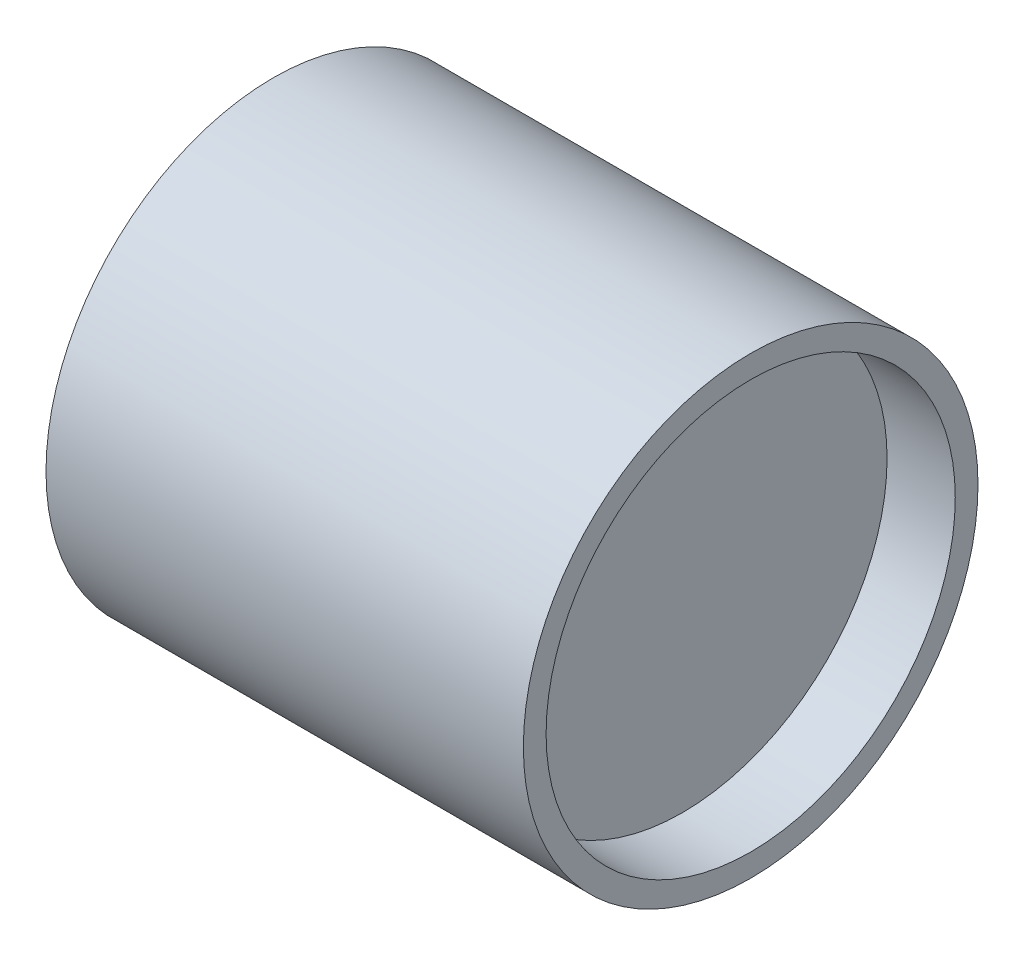
from build123d import *


with BuildPart() as part:
    # Esquisse1 → Base-Révolution (revolve)
    with BuildSketch(Plane.XY, mode=Mode.PRIVATE) as base_r_volution_sk:
        Polygon((-13, 9), (-13, 0), (-28, 0), (-28, 9), (-31, 9), (-31, 10), (-10, 10), (-10, 9), align=None)
    revolve(base_r_volution_sk.sketch.rotate(Axis((-30, 0, 0), (1, 0, 0)), 90), axis=Axis((-30, 0, 0), (1, 0, 0)))


solid = part.part
